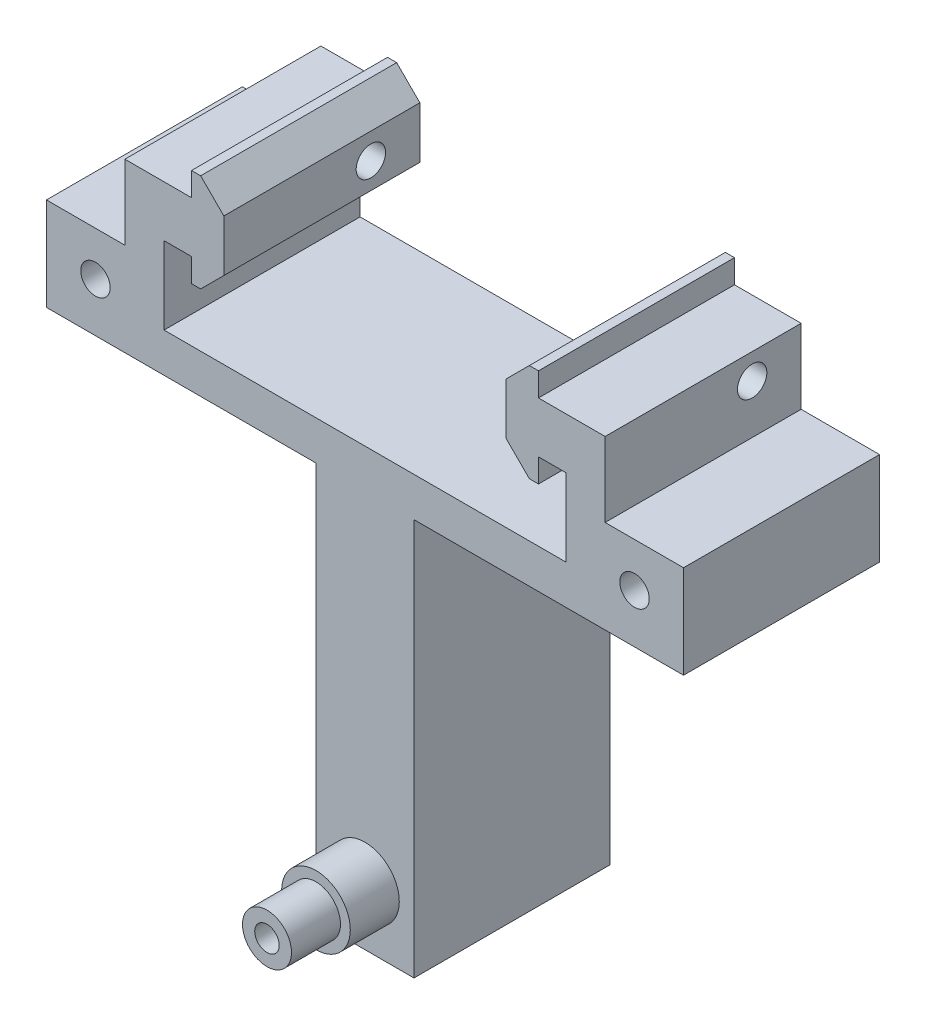
from build123d import *

# Parameters (mm, degrees)
BOSS_EXTRUDE1_DEPTH = 20
SKETCH2_R           = 1.5
CUT_EXTRUDE1_DEPTH  = 60
SKETCH4_R           = 2.5
BOSS_EXTRUDE2_DEPTH = 10
SKETCH5_R           = 3.5
BOSS_EXTRUDE3_DEPTH = 5
SKETCH6_R           = 1.25
CUT_EXTRUDE3_DEPTH  = 4
SKETCH7_W           = 20
SKETCH7_H           = 9.5
BOSS_EXTRUDE4_DEPTH = 8
SKETCH8_W           = 20
SKETCH8_H           = 9.5
BOSS_EXTRUDE5_DEPTH = 8
SKETCH9_R           = 1.5
CUT_EXTRUDE4_DEPTH  = 10


with BuildPart() as part:
    # Sketch1 → Boss-Extrude1 (new body)
    with BuildSketch(Plane.XY):
        Polygon((-14.5, 2.6), (-7.7, 2.6), (-7.7, 5), (-6.767766953, 5), (-4.4, 2.632233047), (-4.4, -2.632233047), (-6.767766953, -5), (-7.7, -5), (-7.7, -2.6), (-10.5, -2.6), (-10.5, -10.5), (30.5, -10.5), (30.5, -2.6), (27.7, -2.6), (27.7, -5), (26.767766953, -5), (24.4, -2.632233047), (24.4, 2.632233047), (26.767766953, 5), (27.7, 5), (27.7, 2.6), (34.5, 2.6), (34.5, -14.5), (15, -14.5), (15, -55), (5, -55), (5, -14.5), (-14.5, -14.5), align=None)
    extrude(amount=BOSS_EXTRUDE1_DEPTH)

    # Sketch2 → Cut-Extrude1 (cut)
    with BuildSketch(Plane.ZY.offset(14.5)):
        with Locations(Location((5, 0, 0), (0, 0, 270))):
            Circle(SKETCH2_R)
    extrude(amount=-CUT_EXTRUDE1_DEPTH, mode=Mode.SUBTRACT)

    # Sketch4 → Boss-Extrude2 (add)
    with BuildSketch(Plane.XY.offset(20)):
        with Locations((10, -49)):
            Circle(SKETCH4_R)
    extrude(amount=BOSS_EXTRUDE2_DEPTH)

    # Sketch5 → Boss-Extrude3 (add)
    with BuildSketch(Plane.XY.offset(20)):
        with Locations((10, -49)):
            Circle(SKETCH5_R)
    extrude(amount=BOSS_EXTRUDE3_DEPTH)

    # Sketch6 → Cut-Extrude3 (cut)
    with BuildSketch(Plane.XY.offset(30)):
        with Locations((10, -49)):
            Circle(SKETCH6_R)
    extrude(amount=-CUT_EXTRUDE3_DEPTH, mode=Mode.SUBTRACT)

    # Sketch7 → Boss-Extrude4 (add)
    with BuildSketch(Plane.ZY.offset(14.5)):
        with Locations((10, -9.75)):
            Rectangle(SKETCH7_W, SKETCH7_H)
    extrude(amount=BOSS_EXTRUDE4_DEPTH)

    # Sketch8 → Boss-Extrude5 (add)
    with BuildSketch(Plane(origin=(34.5, 0, 0), x_dir=(0, 0, -1), z_dir=(1, 0, 0))):
        with Locations((-10, -9.75)):
            Rectangle(SKETCH8_W, SKETCH8_H)
    extrude(amount=BOSS_EXTRUDE5_DEPTH)

    # Sketch9 → Cut-Extrude4 (cut)
    with BuildSketch(Plane.XY.offset(20)):
        with Locations((-17.5, -9.5)):
            Circle(SKETCH9_R)
        with Locations((37.5, -9.5)):
            Circle(SKETCH9_R)
    extrude(amount=-CUT_EXTRUDE4_DEPTH, mode=Mode.SUBTRACT)


solid = part.part
